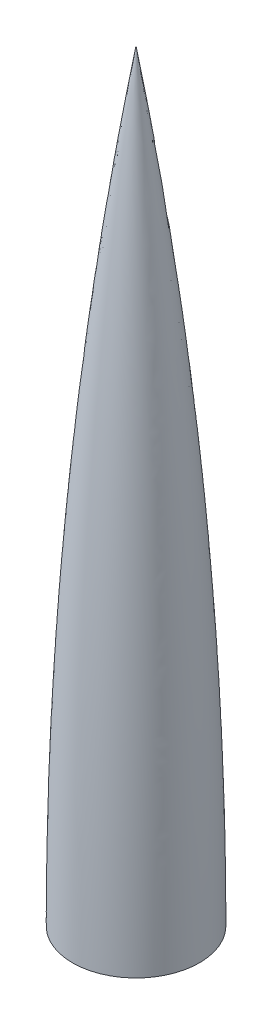
from build123d import *


with BuildPart() as part:
    # Sketch1 → Revolve3 (revolve)
    with BuildSketch(Plane.XY, mode=Mode.PRIVATE) as revolve3_sk:
        with BuildLine():
            Line((-49.53, 0), (-50.8, 0))
            ThreePointArc((-50.8, 0), (-41.079619584, 267.405752277), (-11.969787482, 533.4))
            Line((-11.969787482, 533.4), (-10.686250338, 533.4))
            ThreePointArc((-10.686250338, 533.4), (-39.806221901, 267.406243798), (-49.53, 0))
        make_face()
    revolve(revolve3_sk.sketch.rotate(Axis((0, 609.6, 0), (0, -1, 0)), 270), axis=Axis((0, 609.6, 0), (0, -1, 0)))

    # Sketch3 → Revolve4 (revolve)
    with BuildSketch(Plane.XY, mode=Mode.PRIVATE) as revolve4_sk:
        with BuildLine():
            Line((-11.969787482, 533.4), (0, 533.4))
            Line((0, 533.4), (0, 609.6))
            ThreePointArc((0, 609.6), (-6.18438473, 571.531336808), (-11.969787482, 533.4))
        make_face()
    revolve(revolve4_sk.sketch.rotate(Axis((0, 533.4, 0), (0, 1, 0)), 90), axis=Axis((0, 533.4, 0), (0, 1, 0)))


solid = part.part
